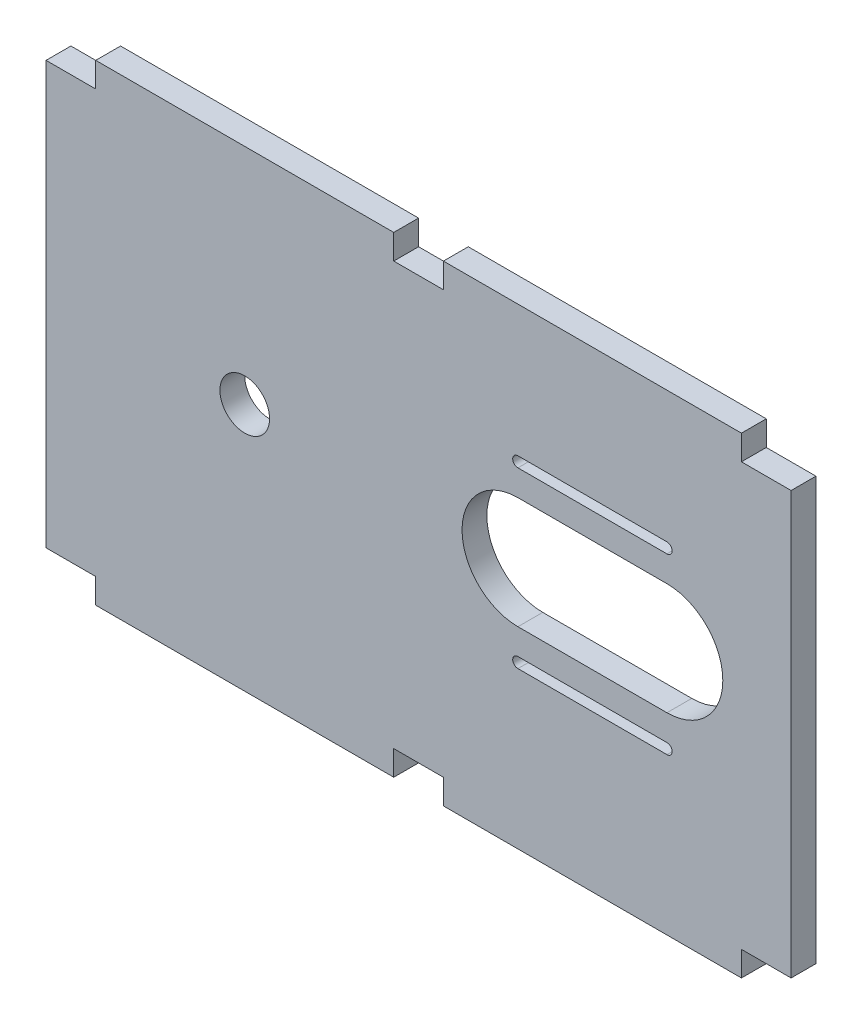
from build123d import *

# Parameters (mm, degrees)
IZIM1_W                     = 300
IZIM1_H                     = 180
IZIM1_R                     = 10
Y_KSEKLIK_EKSTR_ZYON1_DEPTH = 10
IZIM3_W                     = 120
IZIM3_H                     = 10
Y_KSEKLIK_EKSTR_ZYON2_DEPTH = 10
IZIM4_W                     = 20
IZIM4_H                     = 10
KES_EKSTR_ZYON1_DEPTH       = 10


with BuildPart() as part:
    # Çizim1 → Yükseklik-Ekstrüzyon1 (new body)
    with BuildSketch(Plane.XY):
        Rectangle(IZIM1_W, IZIM1_H)
        with Locations((-70, 10)):
            Circle(IZIM1_R, mode=Mode.SUBTRACT)
        with BuildLine():
            Line((100, -12.5), (40, -12.5))
            ThreePointArc((40, -12.5), (17.5, 10), (40, 32.5))
            Line((40, 32.5), (100, 32.5))
            ThreePointArc((100, 32.5), (122.5, 10), (100, -12.5))
        make_face(mode=Mode.SUBTRACT)
        with BuildLine():
            Line((100, 42.9), (40, 42.9))
            ThreePointArc((40, 42.9), (37.9, 45), (40, 47.1))
            Line((40, 47.1), (100, 47.1))
            ThreePointArc((100, 47.1), (102.1, 45), (100, 42.9))
        make_face(mode=Mode.SUBTRACT)
        with BuildLine():
            Line((100, -27.1), (40, -27.1))
            ThreePointArc((40, -27.1), (37.9, -25), (40, -22.9))
            Line((40, -22.9), (100, -22.9))
            ThreePointArc((100, -22.9), (102.1, -25), (100, -27.1))
        make_face(mode=Mode.SUBTRACT)
    extrude(amount=Y_KSEKLIK_EKSTR_ZYON1_DEPTH)

    # Çizim3 → Yükseklik-Ekstrüzyon2 (add)
    with BuildSketch(Plane(origin=(0, 90, 0), x_dir=(1, 0, 0), z_dir=(0, 1, 0))):
        with Locations((70, -5)):
            Rectangle(IZIM3_W, IZIM3_H)
        with Locations((-70, -5)):
            Rectangle(IZIM3_W, IZIM3_H)
    extrude(amount=Y_KSEKLIK_EKSTR_ZYON2_DEPTH)

    # Çizim4 → Kes-Ekstrüzyon1 (cut)
    with BuildSketch(Plane.XZ.offset(90)):
        with Locations((140, 5)):
            Rectangle(IZIM4_W, IZIM4_H)
        with Locations((0, 5)):
            Rectangle(IZIM4_W, IZIM4_H)
        with Locations((-140, 5)):
            Rectangle(IZIM4_W, IZIM4_H)
    extrude(amount=-KES_EKSTR_ZYON1_DEPTH, mode=Mode.SUBTRACT)


solid = part.part
